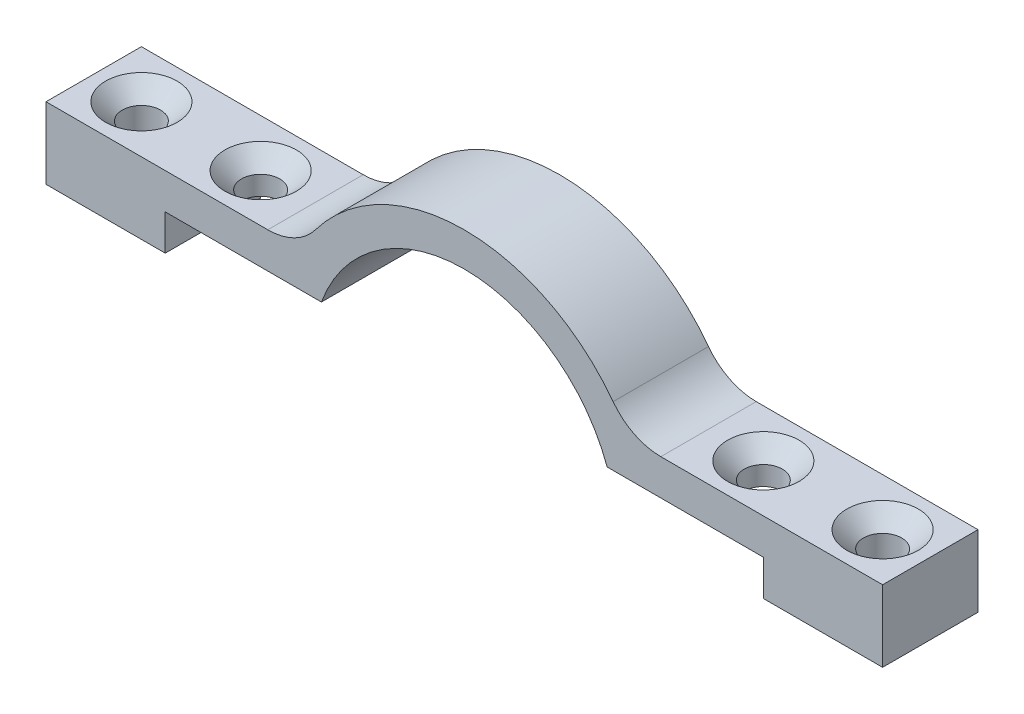
from build123d import *

# Parameters (mm, degrees)
BOSS_EXTRUDE1_DEPTH = 8
HOLE1_D             = 3.2
HOLE1_CSINK_D       = 6
HOLE1_CSINK_ANGLE   = 90
FILLET1_R           = 5


with BuildPart() as part:
    # Sketch1 → Boss-Extrude1 (new body)
    with BuildSketch(Plane.XY):
        with BuildLine():
            Line((-13.754245124, 7.360756827), (-35.078110692, 7.360756827))
            Line((-35.078110692, 7.360756827), (-35.078110692, 1.360756827))
            Line((-35.078110692, 1.360756827), (-25.078110692, 1.360756827))
            Line((-25.078110692, 1.360756827), (-25.078110692, 4.360756827))
            Line((-25.078110692, 4.360756827), (-11.981080915, 4.360756827))
            ThreePointArc((-11.981080915, 4.360756827), (0, 12.75), (11.981080915, 4.360756827))
            Line((11.981080915, 4.360756827), (25.078110692, 4.360756827))
            Line((25.078110692, 4.360756827), (25.078110692, 1.360756827))
            Line((25.078110692, 1.360756827), (35.078110692, 1.360756827))
            Line((35.078110692, 1.360756827), (35.078110692, 7.360756827))
            Line((35.078110692, 7.360756827), (13.754245124, 7.360756827))
            ThreePointArc((13.754245124, 7.360756827), (0, 15.6), (-13.754245124, 7.360756827))
        make_face()
    extrude(amount=BOSS_EXTRUDE1_DEPTH)

    # Hole1 (through all)
    with Locations(Plane(origin=(-21.078110692, 7.360756827, 4), x_dir=(1, 0, 0), z_dir=(0, 1, 0))):
        with Locations((0, 0), (42.156221384, 0), (-10, 0), (52.156221384, 0)):
            CounterSinkHole(HOLE1_D / 2, HOLE1_CSINK_D / 2, counter_sink_angle=HOLE1_CSINK_ANGLE)

    # Fillet1
    fillet1_edges = [part.edges().sort_by_distance(p)[0] for p in [
        (-13.754245124, 7.360756827, 4),
        (13.754245124, 7.360756827, 4),
    ]]
    fillet(fillet1_edges, radius=FILLET1_R)


solid = part.part
